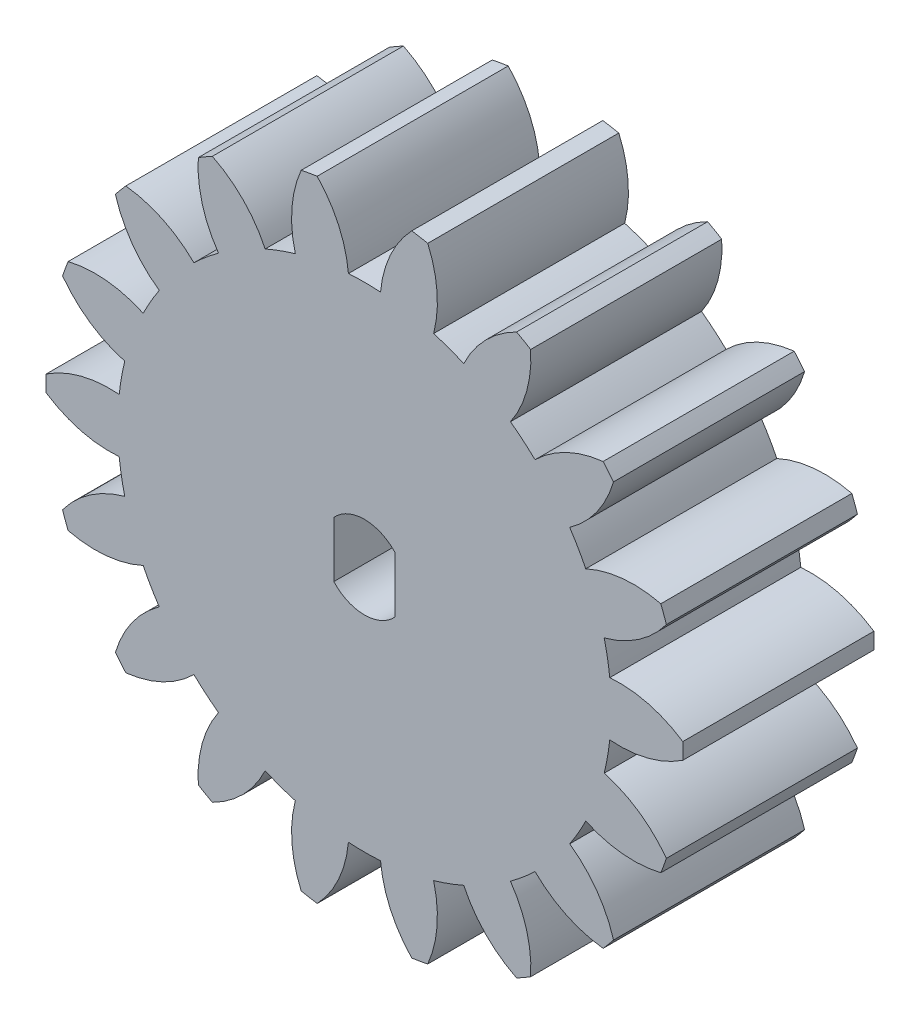
from build123d import *

# Parameters (mm, degrees)
SALIENTE_EXTRUIR1_DEPTH    = 12
CORTAR_EXTRUIR1_DEPTH      = 31.580715245
CORTAR_EXTRUIR1_DEPTH_BACK = 31.580715245


with BuildPart() as part:
    # Croquis2 → Saliente-Extruir1 (new body)
    with BuildSketch(Plane.XY):
        with BuildLine():
            ThreePointArc((-15.643576177, 12.461080386), (-14.593058293, 10.300539912), (-12.890222435, 8.605879768))
            ThreePointArc((-12.890222435, 8.605879768), (-13.422527733, 7.7495), (-13.898021719, 6.860320205))
            ThreePointArc((-13.898021719, 6.860320205), (-16.217058383, 7.487689244), (-18.613400261, 7.317194183))
            ThreePointArc((-18.613400261, 7.317194183), (-18.793852416, 6.840402867), (-18.962093596, 6.359167119))
            ThreePointArc((-18.962093596, 6.359167119), (-17.23598133, 4.688221457), (-15.056231134, 3.678165989))
            ThreePointArc((-15.056231134, 3.678165989), (-15.263535364, 2.691373106), (-15.406236152, 1.693188893))
            ThreePointArc((-15.406236152, 1.693188893), (-17.799990642, 1.489565697), (-19.993502677, 0.509755553))
            ThreePointArc((-19.993502677, 0.509755553), (-20, 0), (-19.993502677, -0.509755553))
            ThreePointArc((-19.993502677, -0.509755553), (-17.799990642, -1.489565697), (-15.406236152, -1.693188893))
            ThreePointArc((-15.406236152, -1.693188893), (-15.263535364, -2.691373106), (-15.056231134, -3.678165989))
            ThreePointArc((-15.056231134, -3.678165989), (-17.23598133, -4.688221457), (-18.962093596, -6.359167119))
            ThreePointArc((-18.962093596, -6.359167119), (-18.793852416, -6.840402867), (-18.613400261, -7.317194183))
            ThreePointArc((-18.613400261, -7.317194183), (-16.217058383, -7.487689244), (-13.898021719, -6.860320205))
            ThreePointArc((-13.898021719, -6.860320205), (-13.422527733, -7.7495), (-12.890222435, -8.605879768))
            ThreePointArc((-12.890222435, -8.605879768), (-14.593058293, -10.300539912), (-15.643576177, -12.461080386))
            ThreePointArc((-15.643576177, -12.461080386), (-15.320888862, -12.855752194), (-14.98824707, -13.242071204))
            ThreePointArc((-14.98824707, -13.242071204), (-12.678109545, -12.582686962), (-10.713500753, -11.199995653))
            ThreePointArc((-10.713500753, -11.199995653), (-9.962565163, -11.872922824), (-9.16946267, -12.495597438))
            ThreePointArc((-9.16946267, -12.495597438), (-10.189997055, -14.670461235), (-10.438212597, -17.060003452))
            ThreePointArc((-10.438212597, -17.060003452), (-10, -17.320508076), (-9.555290079, -17.569759005))
            ThreePointArc((-9.555290079, -17.569759005), (-7.609993587, -16.160026932), (-6.236773482, -14.188786331))
            ThreePointArc((-6.236773482, -14.188786331), (-5.300970201, -14.56429593), (-4.342730381, -14.878161642))
            ThreePointArc((-4.342730381, -14.878161642), (-4.557871785, -17.270908419), (-3.973846526, -19.601238323))
            ThreePointArc((-3.973846526, -19.601238323), (-3.472963553, -19.69615506), (-2.969824084, -19.778274569))
            ThreePointArc((-2.969824084, -19.778274569), (-1.62400009, -17.788229157), (-1.007799284, -15.466199973))
            ThreePointArc((-1.007799284, -15.466199973), (0, -15.499), (1.007799284, -15.466199973))
            ThreePointArc((1.007799284, -15.466199973), (1.62400009, -17.788229157), (2.969824084, -19.778274569))
            ThreePointArc((2.969824084, -19.778274569), (3.472963553, -19.69615506), (3.973846526, -19.601238323))
            ThreePointArc((3.973846526, -19.601238323), (4.557871785, -17.270908419), (4.342730381, -14.878161642))
            ThreePointArc((4.342730381, -14.878161642), (5.300970201, -14.56429593), (6.236773482, -14.188786331))
            ThreePointArc((6.236773482, -14.188786331), (7.609993587, -16.160026932), (9.555290079, -17.569759005))
            ThreePointArc((9.555290079, -17.569759005), (10, -17.320508076), (10.438212597, -17.060003452))
            ThreePointArc((10.438212597, -17.060003452), (10.189997055, -14.670461235), (9.16946267, -12.495597438))
            ThreePointArc((9.16946267, -12.495597438), (9.962565163, -11.872922824), (10.713500753, -11.199995653))
            ThreePointArc((10.713500753, -11.199995653), (12.678109545, -12.582686962), (14.98824707, -13.242071204))
            ThreePointArc((14.98824707, -13.242071204), (15.320888862, -12.855752194), (15.643576177, -12.461080386))
            ThreePointArc((15.643576177, -12.461080386), (14.593058293, -10.300539912), (12.890222435, -8.605879768))
            ThreePointArc((12.890222435, -8.605879768), (13.422527733, -7.7495), (13.898021719, -6.860320205))
            ThreePointArc((13.898021719, -6.860320205), (16.217058383, -7.487689244), (18.613400261, -7.317194183))
            ThreePointArc((18.613400261, -7.317194183), (18.793852416, -6.840402867), (18.962093596, -6.359167119))
            ThreePointArc((18.962093596, -6.359167119), (17.23598133, -4.688221457), (15.056231134, -3.678165989))
            ThreePointArc((15.056231134, -3.678165989), (15.263535364, -2.691373106), (15.406236152, -1.693188893))
            ThreePointArc((15.406236152, -1.693188893), (17.799990642, -1.489565697), (19.993502677, -0.509755553))
            ThreePointArc((19.993502677, -0.509755553), (20, 0), (19.993502677, 0.509755553))
            ThreePointArc((19.993502677, 0.509755553), (17.799990642, 1.489565697), (15.406236152, 1.693188893))
            ThreePointArc((15.406236152, 1.693188893), (15.263535364, 2.691373106), (15.056231134, 3.678165989))
            ThreePointArc((15.056231134, 3.678165989), (17.23598133, 4.688221457), (18.962093596, 6.359167119))
            ThreePointArc((18.962093596, 6.359167119), (18.793852416, 6.840402867), (18.613400261, 7.317194183))
            ThreePointArc((18.613400261, 7.317194183), (16.217058383, 7.487689244), (13.898021719, 6.860320205))
            ThreePointArc((13.898021719, 6.860320205), (13.422527733, 7.7495), (12.890222435, 8.605879768))
            ThreePointArc((12.890222435, 8.605879768), (14.593058293, 10.300539912), (15.643576177, 12.461080386))
            ThreePointArc((15.643576177, 12.461080386), (15.320888862, 12.855752194), (14.98824707, 13.242071204))
            ThreePointArc((14.98824707, 13.242071204), (12.678109545, 12.582686962), (10.713500753, 11.199995653))
            ThreePointArc((10.713500753, 11.199995653), (9.962565163, 11.872922824), (9.16946267, 12.495597438))
            ThreePointArc((9.16946267, 12.495597438), (10.189997055, 14.670461235), (10.438212597, 17.060003452))
            ThreePointArc((10.438212597, 17.060003452), (10, 17.320508076), (9.555290079, 17.569759005))
            ThreePointArc((9.555290079, 17.569759005), (7.609993587, 16.160026932), (6.236773482, 14.188786331))
            ThreePointArc((6.236773482, 14.188786331), (5.300970201, 14.56429593), (4.342730381, 14.878161642))
            ThreePointArc((4.342730381, 14.878161642), (4.557871785, 17.270908419), (3.973846526, 19.601238323))
            ThreePointArc((3.973846526, 19.601238323), (3.472963553, 19.69615506), (2.969824084, 19.778274569))
            ThreePointArc((2.969824084, 19.778274569), (1.62400009, 17.788229157), (1.007799284, 15.466199973))
            ThreePointArc((1.007799284, 15.466199973), (0, 15.499), (-1.007799284, 15.466199973))
            ThreePointArc((-1.007799284, 15.466199973), (-1.62400009, 17.788229157), (-2.969824084, 19.778274569))
            ThreePointArc((-2.969824084, 19.778274569), (-3.472963553, 19.69615506), (-3.973846526, 19.601238323))
            ThreePointArc((-3.973846526, 19.601238323), (-4.557871785, 17.270908419), (-4.342730381, 14.878161642))
            ThreePointArc((-4.342730381, 14.878161642), (-5.300970201, 14.56429593), (-6.236773482, 14.188786331))
            ThreePointArc((-6.236773482, 14.188786331), (-7.609993587, 16.160026932), (-9.555290079, 17.569759005))
            ThreePointArc((-9.555290079, 17.569759005), (-10, 17.320508076), (-10.438212597, 17.060003452))
            ThreePointArc((-10.438212597, 17.060003452), (-10.189997055, 14.670461235), (-9.16946267, 12.495597438))
            ThreePointArc((-9.16946267, 12.495597438), (-9.962565163, 11.872922824), (-10.713500753, 11.199995653))
            ThreePointArc((-10.713500753, 11.199995653), (-12.678109545, 12.582686962), (-14.98824707, 13.242071204))
            ThreePointArc((-14.98824707, 13.242071204), (-15.320888862, 12.855752194), (-15.643576177, 12.461080386))
        make_face()
    extrude(amount=SALIENTE_EXTRUIR1_DEPTH)

    # Croquis3 → Cortar-Extruir1 (cut, two sides: drawn at the far end of the back side and taken through both)
    with BuildSketch(Plane.XY.offset(12).offset(-CORTAR_EXTRUIR1_DEPTH_BACK)):
        with BuildLine():
            Line((-1.925, -1.74767703), (-1.925, 1.74767703))
            ThreePointArc((-1.925, 1.74767703), (0, 2.6), (1.925, 1.74767703))
            Line((1.925, 1.74767703), (1.925, -1.74767703))
            ThreePointArc((1.925, -1.74767703), (0, -2.6), (-1.925, -1.74767703))
        make_face()
    extrude(amount=CORTAR_EXTRUIR1_DEPTH + CORTAR_EXTRUIR1_DEPTH_BACK, mode=Mode.SUBTRACT)


solid = part.part
